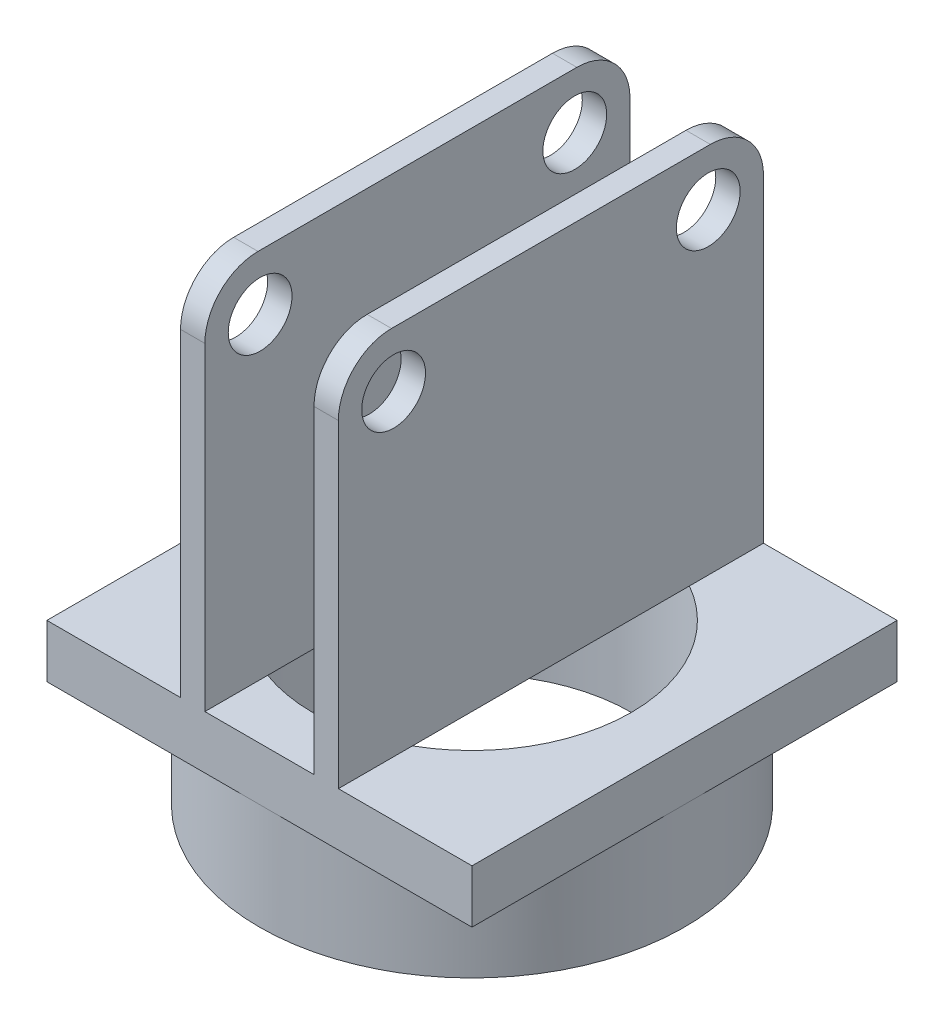
from build123d import *

# Parameters (mm, degrees)
SKETCH1_R           = 20
SKETCH1_R_2         = 15
BOSS_EXTRUDE1_DEPTH = 10
SKETCH3_W           = 40
SKETCH3_H           = 40
BOSS_EXTRUDE2_DEPTH = 5
SKETCH5_R           = 15
CUT_EXTRUDE1_DEPTH  = 5
SKETCH7_W           = 14.853626256
SKETCH7_H           = 40
BOSS_EXTRUDE3_DEPTH = 35
FILLET1_R           = 5
FILLET2_R           = 5
SKETCH8_R           = 3
CUT_EXTRUDE2_DEPTH  = 35
SKETCH9_W           = 10.266740892
SKETCH9_H           = 48.673472914
CUT_EXTRUDE5_DEPTH  = 35


with BuildPart() as part:
    # Sketch1 → Boss-Extrude1 (new body)
    with BuildSketch(Plane(origin=(0, 0, 0), x_dir=(1, 0, 0), z_dir=(0, 1, 0))):
        with Locations(Location((0, 0, 0), (0, 0, 270))):
            Circle(SKETCH1_R)
        with Locations(Location((0, 0, 0), (0, 0, 270))):
            Circle(SKETCH1_R_2, mode=Mode.SUBTRACT)
    extrude(amount=BOSS_EXTRUDE1_DEPTH)

    # Sketch3 → Boss-Extrude2 (add)
    with BuildSketch(Plane(origin=(0, 10, 0), x_dir=(1, 0, 0), z_dir=(0, 1, 0))):
        Rectangle(SKETCH3_W, SKETCH3_H)
    extrude(amount=BOSS_EXTRUDE2_DEPTH)

    # Sketch5 → Cut-Extrude1 (cut)
    with BuildSketch(Plane.XZ.offset(-10)):
        with Locations(Location((0, 0, 0), (0, 0, 270))):
            Circle(SKETCH5_R)
    extrude(amount=-CUT_EXTRUDE1_DEPTH, mode=Mode.SUBTRACT)

    # Sketch7 → Boss-Extrude3 (add)
    with BuildSketch(Plane(origin=(0, 15, 0), x_dir=(1, 0, 0), z_dir=(0, 1, 0))):
        Rectangle(SKETCH7_W, SKETCH7_H)
    extrude(amount=BOSS_EXTRUDE3_DEPTH)

    # Fillet1
    fillet1_edges = [part.edges().sort_by_distance(p)[0] for p in [
        (0, 50, 20),
    ]]
    fillet(fillet1_edges, radius=FILLET1_R)

    # Fillet2
    fillet2_edges = [part.edges().sort_by_distance(p)[0] for p in [
        (0, 50, -20),
    ]]
    fillet(fillet2_edges, radius=FILLET2_R)

    # Sketch8 → Cut-Extrude2 (cut)
    with BuildSketch(Plane(origin=(7.426813128, 0, 0), x_dir=(0, 0, -1), z_dir=(1, 0, 0))):
        with Locations((-14.80323114, 44.772968188)):
            Circle(SKETCH8_R)
        with Locations((14.80323114, 44.772968188)):
            Circle(SKETCH8_R)
    extrude(amount=-CUT_EXTRUDE2_DEPTH, mode=Mode.SUBTRACT)

    # Sketch9 → Cut-Extrude5 (cut)
    with BuildSketch(Plane(origin=(0, 50, 0), x_dir=(1, 0, 0), z_dir=(0, 1, 0))):
        Rectangle(SKETCH9_W, SKETCH9_H)
    extrude(amount=-CUT_EXTRUDE5_DEPTH, mode=Mode.SUBTRACT)


solid = part.part
